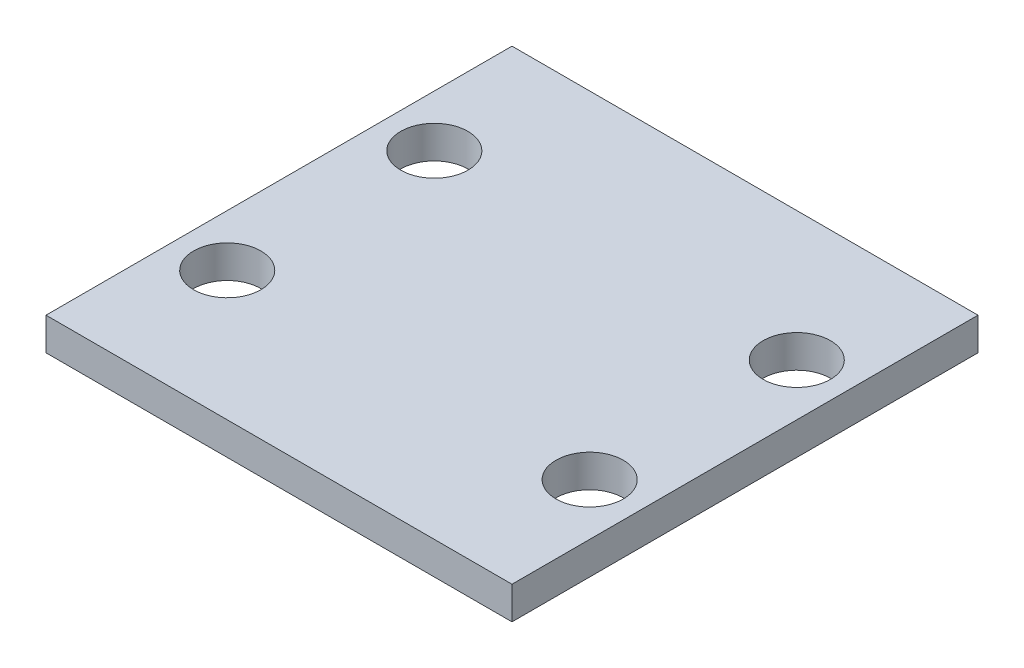
from build123d import *

# Parameters (mm, degrees)
SKETCH1_W           = 22.86
SKETCH1_H           = 22.86
SKETCH1_R           = 1.65
BOSS_EXTRUDE1_DEPTH = 1.6


with BuildPart() as part:
    # Sketch1 → Boss-Extrude1 (new body)
    with BuildSketch(Plane(origin=(0, 0, 0), x_dir=(1, 0, 0), z_dir=(0, 1, 0))):
        Rectangle(SKETCH1_W, SKETCH1_H)
        with Locations(Location((-8.89, 5.08, 0), (0, 0, 270))):
            Circle(SKETCH1_R, mode=Mode.SUBTRACT)
        with Locations(Location((-8.89, -5.08, 0), (0, 0, 270))):
            Circle(SKETCH1_R, mode=Mode.SUBTRACT)
        with Locations(Location((8.89, -5.08, 0), (0, 0, 270))):
            Circle(SKETCH1_R, mode=Mode.SUBTRACT)
        with Locations(Location((8.89, 5.08, 0), (0, 0, 270))):
            Circle(SKETCH1_R, mode=Mode.SUBTRACT)
    extrude(amount=BOSS_EXTRUDE1_DEPTH)


solid = part.part
